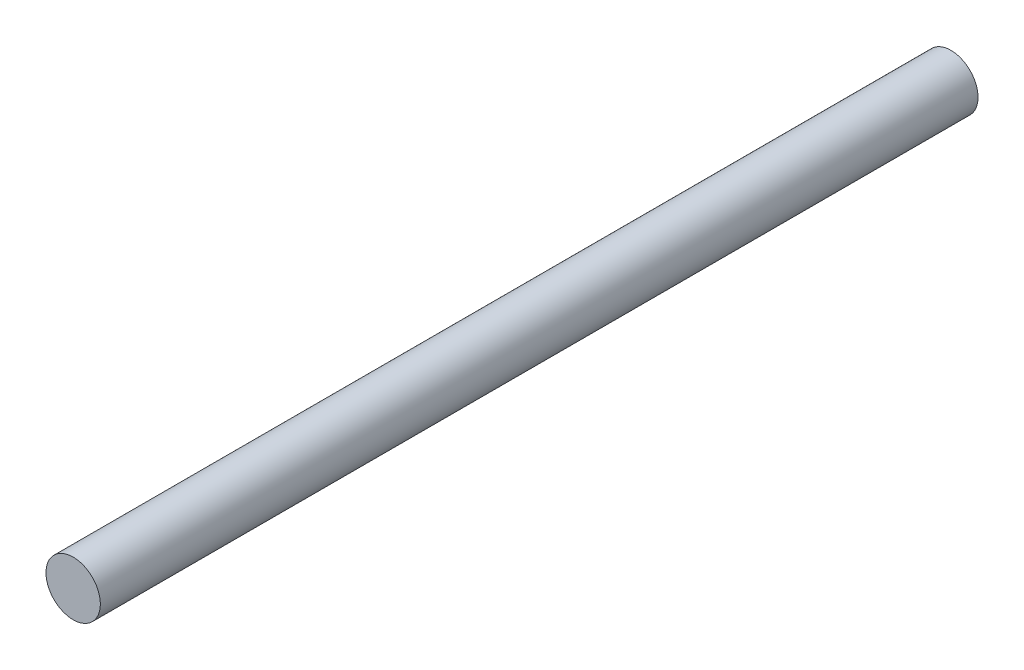
from build123d import *

# Parameters (mm, degrees)
SKETCH1_R           = 2.5
BOSS_EXTRUDE1_DEPTH = 304.8
CUT_EXTRUDE1_START  = -224
SKETCH2_R           = 2.5
CUT_EXTRUDE1_DEPTH  = 224


with BuildPart() as part:
    # Sketch1 → Boss-Extrude1 (new body)
    with BuildSketch(Plane.XY):
        with Locations(Location((0, 0, 0), (0, 0, 180))):
            Circle(SKETCH1_R)
    extrude(amount=BOSS_EXTRUDE1_DEPTH)

    # Sketch2 → Cut-Extrude1 (cut)
    with BuildSketch(Plane.XY.offset(304.8).offset(CUT_EXTRUDE1_START)):
        with Locations(Location((0, 0, 0), (0, 0, 180))):
            Circle(SKETCH2_R)
    extrude(amount=CUT_EXTRUDE1_DEPTH, mode=Mode.SUBTRACT)


solid = part.part
